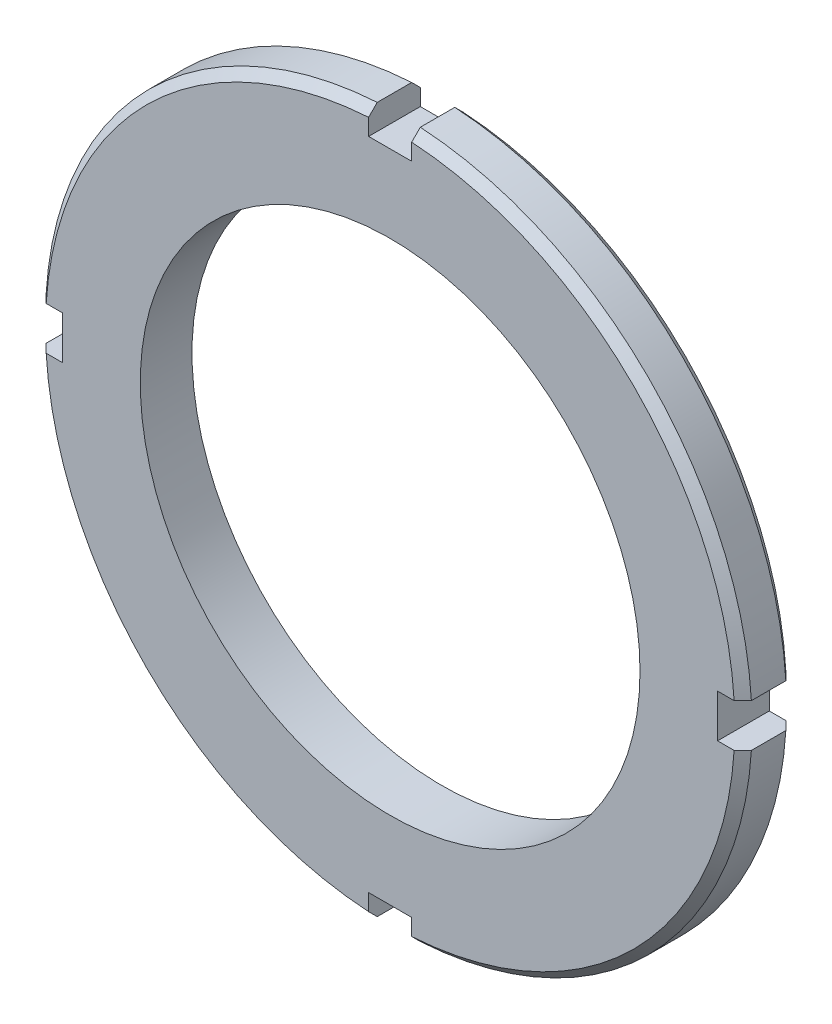
from build123d import *

# Parameters (mm, degrees)
SKETCH_1_R               = 41
EXTRUDE_1_DEPTH          = 6
HOLE_WIZARD_M64_1_D      = 58
CHAMFER_1_SIZE           = 1
SKETCH_5_W               = 3
SKETCH_5_H               = 5
CUT_EXTRUDE_1_DEPTH      = 59.292366567
PATTERN_CIRCULAR_1_COUNT = 4


with BuildPart() as part:
    # 草图1 → 凸台-拉伸1 (new body)
    with BuildSketch(Plane.XY):
        Circle(SKETCH_1_R)
    extrude(amount=EXTRUDE_1_DEPTH)

    # M64 螺纹孔1 (through all)
    with Locations(Plane.XY.offset(6)):
        with Locations((0, 0)):
            Hole(HOLE_WIZARD_M64_1_D / 2)

    # 倒角1
    chamfer_1_edges = [part.edges().sort_by_distance(p)[0] for p in [
        (-41, 0, 0),
        (-41, 0, 6),
    ]]
    chamfer(chamfer_1_edges, length=CHAMFER_1_SIZE)

    # 草图5 → 切除-拉伸1 (cut, through all)
    with BuildSketch(Plane.XY.offset(6)):
        with Locations((39.5, 0)):
            Rectangle(SKETCH_5_W, SKETCH_5_H)
    cut_extrude_1 = extrude(amount=-CUT_EXTRUDE_1_DEPTH, mode=Mode.SUBTRACT)

    # 阵列(圆周)1: 切除-拉伸1 ×4 about axis
    pattern_circular_1_axis = Axis((0, 0, 0), (0, 0, 1))
    for i in range(1, PATTERN_CIRCULAR_1_COUNT):
        add(cut_extrude_1.rotate(pattern_circular_1_axis, i * 360 / PATTERN_CIRCULAR_1_COUNT), mode=Mode.SUBTRACT)


solid = part.part
